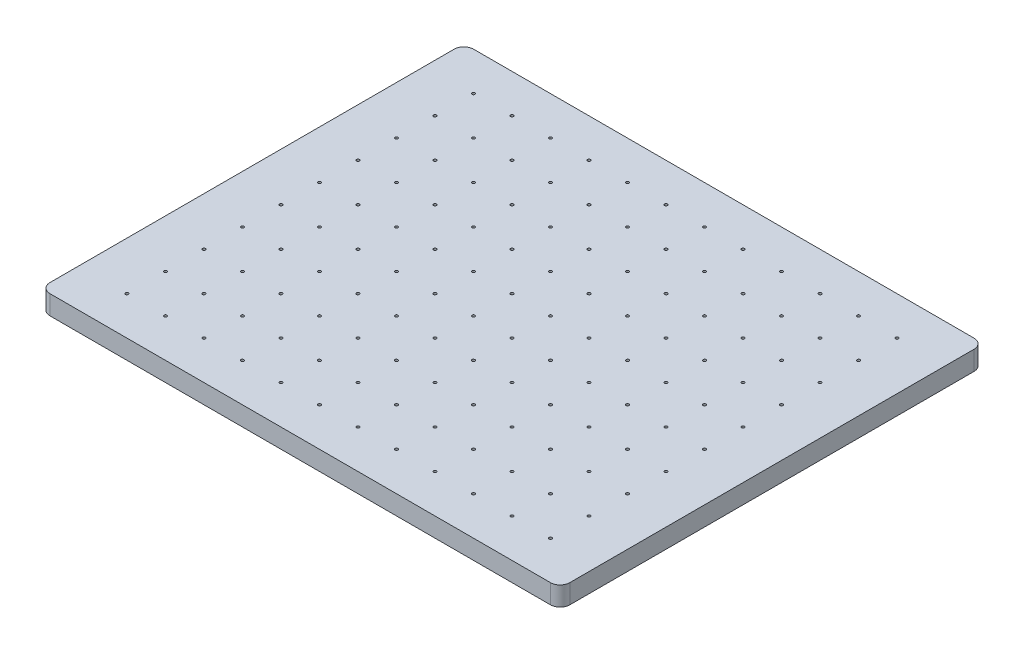
from build123d import *

# Parameters (mm, degrees)
SKETCH1_W                  = 270
SKETCH1_H                  = 220
BOSS_EXTRUDE1_DEPTH        = 10
F_1_5_1_5_DIAMETER_HOLE1_D = 1.5
LPATTERN1_COUNT            = 12
LPATTERN1_PITCH            = 20
LPATTERN1_COUNT_DIR2       = 10
LPATTERN1_PITCH_DIR2       = 20
FILLET1_R                  = 5


with BuildPart() as part:
    # Sketch1 → Boss-Extrude1 (new body)
    with BuildSketch(Plane(origin=(0, 0, 0), x_dir=(1, 0, 0), z_dir=(0, 1, 0))):
        Rectangle(SKETCH1_W, SKETCH1_H)
    extrude(amount=BOSS_EXTRUDE1_DEPTH)

    # Ø1.5 (1.5) Diameter Hole1 (through all)
    with Locations(Plane(origin=(-110, 10, -90), x_dir=(0, 0, 1), z_dir=(0, 1, 0))):
        with Locations((0, 0)):
            f_1_5_1_5_diameter_hole1 = Hole(F_1_5_1_5_DIAMETER_HOLE1_D / 2)

    # LPattern1: 1.5 _1.5_ Diameter Hole1 12 × 10
    with Locations(*[(i * LPATTERN1_PITCH, 0, j * LPATTERN1_PITCH_DIR2) for i in range(LPATTERN1_COUNT) for j in range(LPATTERN1_COUNT_DIR2) if (i, j) != (0, 0)]):
        add(f_1_5_1_5_diameter_hole1, mode=Mode.SUBTRACT)

    # Fillet1
    fillet1_edges = [part.edges().sort_by_distance(p)[0] for p in [
        (-135, 5, -110),
        (135, 5, -110),
        (135, 5, 110),
        (-135, 5, 110),
    ]]
    fillet(fillet1_edges, radius=FILLET1_R)


solid = part.part
